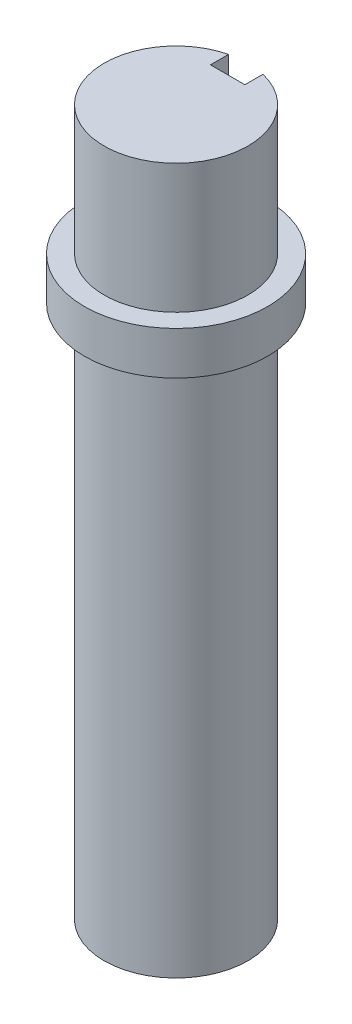
from build123d import *

# Parameters (mm, degrees)
SKETCH1_R           = 8.35
BOSS_EXTRUDE1_DEPTH = 82
SKETCH2_R           = 10.65
BOSS_EXTRUDE2_DEPTH = 5
SKETCH3_W           = 4
SKETCH3_H           = 8.442622751
CUT_EXTRUDE1_DEPTH  = 15


with BuildPart() as part:
    # Sketch1 → Boss-Extrude1 (new body)
    with BuildSketch(Plane(origin=(0, 0, 0), x_dir=(1, 0, 0), z_dir=(0, 1, 0))):
        with Locations(Location((0, 0, 0), (0, 0, 270))):
            Circle(SKETCH1_R)
    extrude(amount=BOSS_EXTRUDE1_DEPTH)

    # Sketch2 → Boss-Extrude2 (add)
    with BuildSketch(Plane(origin=(0, 62, 0), x_dir=(1, 0, 0), z_dir=(0, 1, 0))):
        with Locations(Location((0, 0, 0), (0, 0, 270))):
            Circle(SKETCH2_R)
    extrude(amount=BOSS_EXTRUDE2_DEPTH)

    # Sketch3 → Cut-Extrude1 (cut)
    with BuildSketch(Plane(origin=(0, 82, 0), x_dir=(1, 0, 0), z_dir=(0, 1, 0))):
        with Locations((0, 10.221311376)):
            Rectangle(SKETCH3_W, SKETCH3_H)
    extrude(amount=-CUT_EXTRUDE1_DEPTH, mode=Mode.SUBTRACT)


solid = part.part
